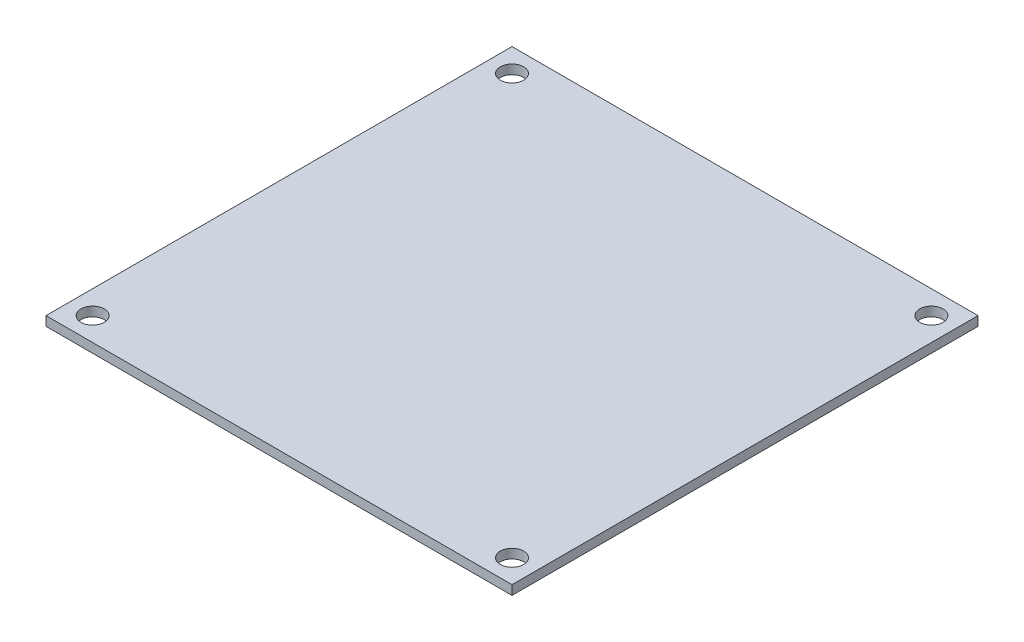
from build123d import *

# Parameters (mm, degrees)
ESQUISSE1_W      = 80
ESQUISSE1_H      = 80
ESQUISSE1_R      = 2
EXTRUSION1_DEPTH = 1.6


with BuildPart() as part:
    # Esquisse1 → Extrusion1 (new body)
    with BuildSketch(Plane(origin=(0, 0, 0), x_dir=(1, 0, 0), z_dir=(0, 1, 0))):
        Rectangle(ESQUISSE1_W, ESQUISSE1_H)
        with Locations(Location((-36, 36, 0), (0, 0, 270))):
            Circle(ESQUISSE1_R, mode=Mode.SUBTRACT)
        with Locations(Location((36, 36, 0), (0, 0, 90))):
            Circle(ESQUISSE1_R, mode=Mode.SUBTRACT)
        with Locations(Location((36, -36, 0), (0, 0, 270))):
            Circle(ESQUISSE1_R, mode=Mode.SUBTRACT)
        with Locations(Location((-36, -36, 0), (0, 0, 90))):
            Circle(ESQUISSE1_R, mode=Mode.SUBTRACT)
    extrude(amount=EXTRUSION1_DEPTH)


solid = part.part
